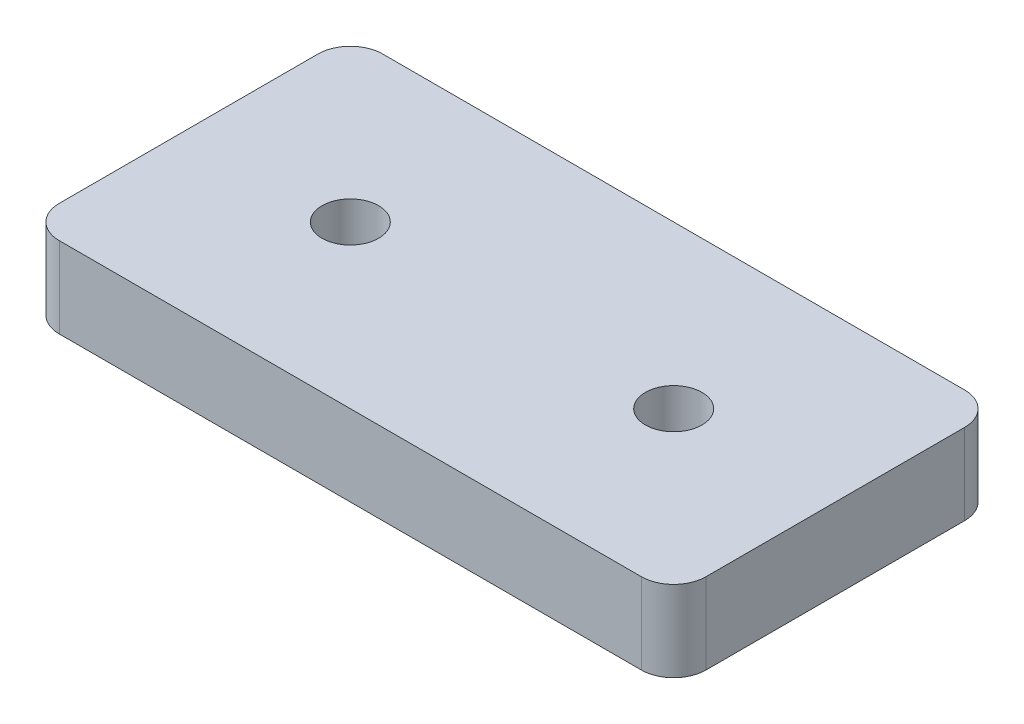
from build123d import *

# Parameters (mm, degrees)
SKETCH_1_R      = 1.75
EXTRUDE_1_DEPTH = 5
FILLET_1_R      = 2
FILLET_2_R      = 2
FILLET_3_R      = 2


with BuildPart() as part:
    # 草图1 → 凸台-拉伸1 (new body)
    with BuildSketch(Plane(origin=(0, 0, 0), x_dir=(1, 0, 0), z_dir=(0, 1, 0))):
        Polygon((-10, 10), (-10, -10), (10, -10), (30, -10), (30, 10), (10, 10), align=None)
        with Locations(Location((0, 0, 0), (0, 0, 270))):
            Circle(SKETCH_1_R, mode=Mode.SUBTRACT)
        with Locations(Location((20, 0, 0), (0, 0, 270))):
            Circle(SKETCH_1_R, mode=Mode.SUBTRACT)
    extrude(amount=EXTRUDE_1_DEPTH)

    # 圆角1
    fillet_1_edges = [part.edges().sort_by_distance(p)[0] for p in [
        (30, 2.5, 10),
        (30, 2.5, -10),
    ]]
    fillet(fillet_1_edges, radius=FILLET_1_R)

    # 圆角2
    fillet_2_edges = [part.edges().sort_by_distance(p)[0] for p in [
        (-10, 2.5, 10),
    ]]
    fillet(fillet_2_edges, radius=FILLET_2_R)

    # 圆角3
    fillet_3_edges = [part.edges().sort_by_distance(p)[0] for p in [
        (-10, 2.5, -10),
    ]]
    fillet(fillet_3_edges, radius=FILLET_3_R)


solid = part.part
